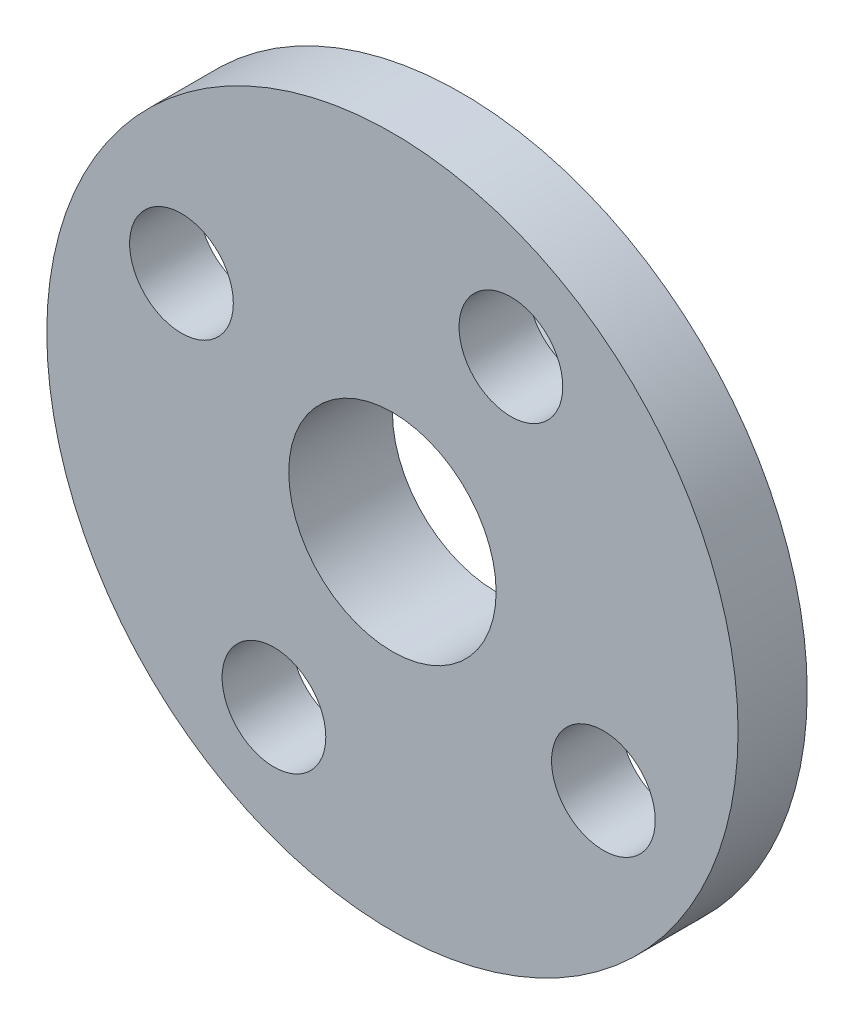
from build123d import *

# Parameters (mm, degrees)
SKETCH_1_R          = 5
SKETCH_1_R_2        = 3
EXTRUDE_1_DEPTH     = 1
SKETCH_2_R          = 10
SKETCH_2_R_2        = 3
EXTRUDE_2_DEPTH     = 2
SKETCH_3_R          = 1.5
CUT_EXTRUDE_1_DEPTH = 15.456832295


with BuildPart() as part:
    # 草图1 → 凸台-拉伸1 (new body)
    with BuildSketch(Plane.XY):
        Circle(SKETCH_1_R)
        Circle(SKETCH_1_R_2, mode=Mode.SUBTRACT)
    extrude(amount=EXTRUDE_1_DEPTH)

    # 草图2 → 凸台-拉伸2 (add)
    with BuildSketch(Plane.XY.offset(1)):
        Circle(SKETCH_2_R)
        Circle(SKETCH_2_R_2, mode=Mode.SUBTRACT)
    extrude(amount=EXTRUDE_2_DEPTH)

    # 草图3 → 切除-拉伸1 (cut, through all)
    with BuildSketch(Plane.XY.offset(3)):
        with Locations((3.427604113, 6.103403153)):
            Circle(SKETCH_3_R)
        with Locations((6.103403153, -3.427604113)):
            Circle(SKETCH_3_R)
        with Locations((-3.427604113, -6.103403153)):
            Circle(SKETCH_3_R)
        with Locations((-6.103403153, 3.427604113)):
            Circle(SKETCH_3_R)
    extrude(amount=-CUT_EXTRUDE_1_DEPTH, mode=Mode.SUBTRACT)


solid = part.part
